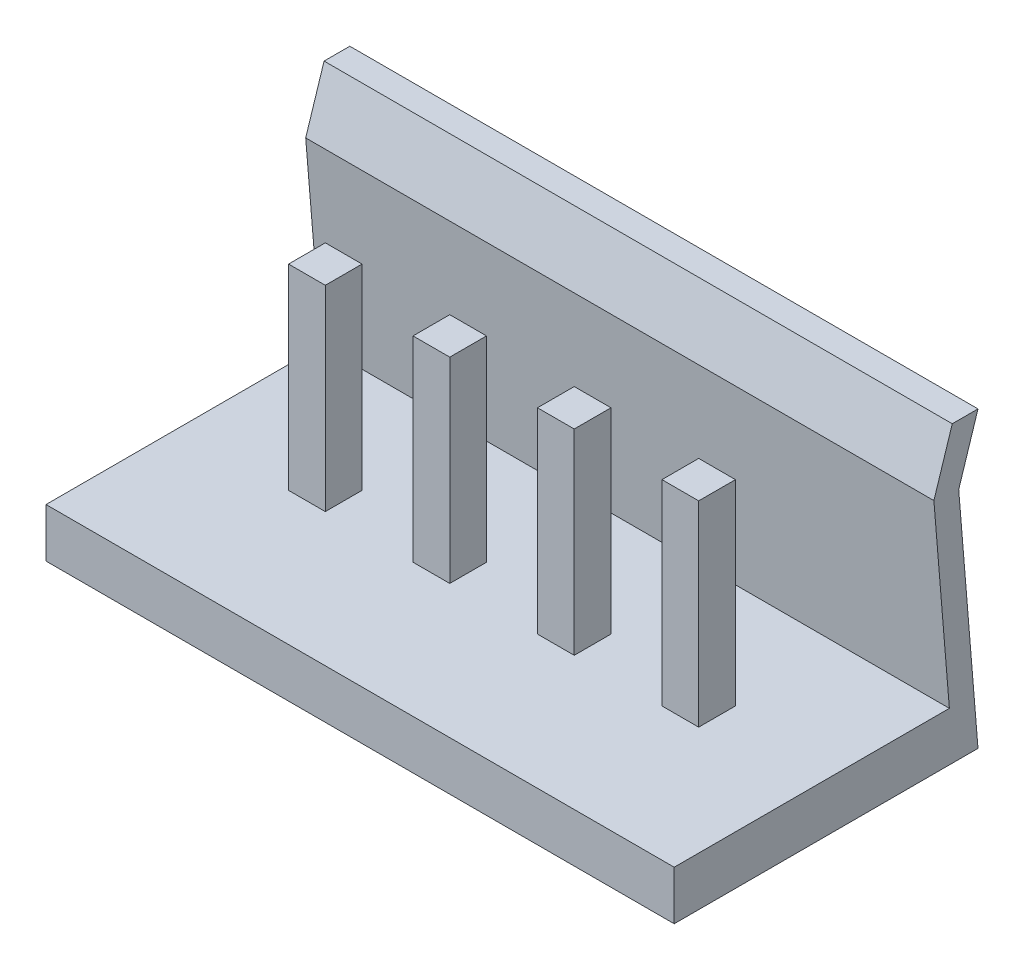
from build123d import *

# Parameters (mm, degrees)
SKETCH_1_W           = 12.82
SKETCH_1_H           = 6.2
EXTRUDE_1_DEPTH      = 6
SKETCH_2_W           = 12.82
SKETCH_2_H           = 5.2
CUT_EXTRUDE_1_DEPTH  = 5
CUT_EXTRUDE_2_DEPTH  = 15.490079365
CUT_EXTRUDE_3_DEPTH  = 15.490079365
EXTRUDE_2_DEPTH      = 2
EXTRUDE_2_DEPTH_BACK = 5
SKETCH_4_W           = 0.75
SKETCH_4_H           = 0.75


with BuildPart() as part:
    # 草图1 → 拉伸1 (new body)
    with BuildSketch(Plane(origin=(0, 0, 0), x_dir=(1, 0, 0), z_dir=(0, 1, 0))):
        Rectangle(SKETCH_1_W, SKETCH_1_H)
    extrude(amount=EXTRUDE_1_DEPTH)

    # 草图2 → 切除-拉伸1 (cut)
    with BuildSketch(Plane(origin=(0, 6, 0), x_dir=(-1, 0, 0), z_dir=(0, 1, 0))):
        with Locations((0, 0.5)):
            Rectangle(SKETCH_2_W, SKETCH_2_H)
    extrude(amount=-CUT_EXTRUDE_1_DEPTH, mode=Mode.SUBTRACT)

    # 草图5 → 切除-拉伸2 (cut, through all)
    with BuildSketch(Plane.ZY.offset(6.41)):
        Polygon((-3.1, 6), (-2.706299213, 4.771653543), (-3.1, 0), align=None)
    extrude(amount=-CUT_EXTRUDE_2_DEPTH, mode=Mode.SUBTRACT)

    # 草图6 → 切除-拉伸3 (cut, through all)
    with BuildSketch(Plane.ZY.offset(6.41)):
        Polygon((-2.1, 1), (-2.1, 6), (-2.574945606, 6), (-2.19981878, 4.829604305), (-2.515792733, 1), align=None)
    extrude(amount=-CUT_EXTRUDE_3_DEPTH, mode=Mode.SUBTRACT)

    # 草图4 → 拉伸2 (add, two sides: drawn at the far end of the back side and taken through both)
    with BuildSketch(Plane.XZ.offset(-EXTRUDE_2_DEPTH_BACK)):
        with Locations((-1.27, 0)):
            Rectangle(SKETCH_4_W, SKETCH_4_H)
        with Locations((1.27, 0)):
            Rectangle(SKETCH_4_W, SKETCH_4_H)
        with Locations((3.81, 0)):
            Rectangle(SKETCH_4_W, SKETCH_4_H)
        with Locations((-3.81, 0)):
            Rectangle(SKETCH_4_W, SKETCH_4_H)
    extrude(amount=EXTRUDE_2_DEPTH + EXTRUDE_2_DEPTH_BACK)


solid = part.part
